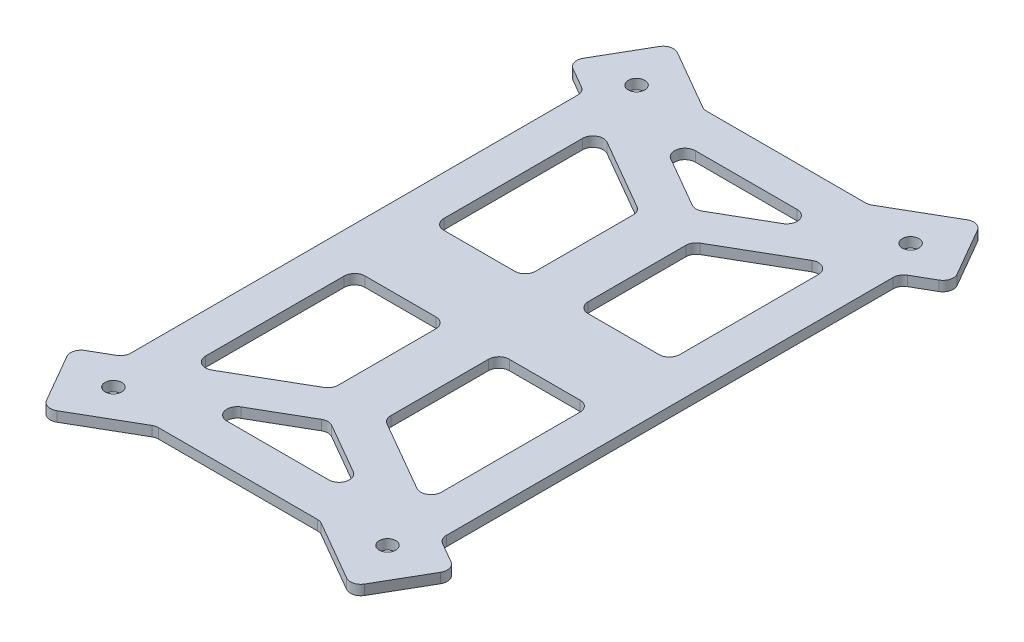
from build123d import *

# Parameters (mm, degrees)
SKETCH2_W               = 48.26
SKETCH2_H               = 83.82
SKETCH2_R               = 1.27
BOSS_EXTRUDE1_DEPTH     = 1.524
SKETCH3_R               = 1.27
BOSS_EXTRUDE2_DEPTH     = 1.524
MIRROR2_COPY_1_SKETCH_R = 1.27
MIRROR2_COPY_1_DEPTH    = 1.524
CUT_EXTRUDE1_DEPTH      = 1.524
MIRROR4_COPY_1_DEPTH    = 1.524
FILLET1_R               = 1.5875


with BuildPart() as part:
    # Sketch2 → Boss-Extrude1 (new body)
    with BuildSketch(Plane(origin=(0, 0, 0), x_dir=(1, 0, 0), z_dir=(0, 1, 0))):
        with Locations((0, -100.64115)):
            Rectangle(SKETCH2_W, SKETCH2_H)
        with Locations(Location((20.955, -140.6398, 0), (0, 0, 90))):
            Circle(SKETCH2_R, mode=Mode.SUBTRACT)
        with Locations(Location((-20.955, -140.6398, 0), (0, 0, 90))):
            Circle(SKETCH2_R, mode=Mode.SUBTRACT)
        with Locations(Location((20.955, -60.6425, 0), (0, 0, 90))):
            Circle(SKETCH2_R, mode=Mode.SUBTRACT)
        with Locations(Location((-20.955, -60.6425, 0), (0, 0, 90))):
            Circle(SKETCH2_R, mode=Mode.SUBTRACT)
    extrude(amount=BOSS_EXTRUDE1_DEPTH)

    # Sketch3 → Boss-Extrude2 (add, through all)
    with BuildSketch(Plane(origin=(0, 0, 0), x_dir=(1, 0, 0), z_dir=(0, 1, 0))):
        Polygon((-2.921, -67.681554482), (23.533261314, -52.408179591), (29.375261314, -62.526820409), (2.921, -77.8001953), align=None)
        with Locations(Location((20.955, -60.6425, 0), (0, 0, 90))):
            Circle(SKETCH3_R, mode=Mode.SUBTRACT)
    boss_extrude2 = extrude(amount=BOSS_EXTRUDE2_DEPTH)

    # Mirror1: Boss-Extrude2 across plane
    add(boss_extrude2.mirror(Plane.XY.offset(100.64115)))

    # Mirror2: Boss-Extrude2 across plane
    add(boss_extrude2.mirror(Plane(origin=(0, 0, 0), x_dir=(0, 0, 1), z_dir=(1, 0, 0))))

    # Mirror2 copy 1 sketch → Mirror2 copy 1 (add, through all)
    with BuildSketch(Plane(origin=(0, 0, 201.2823), x_dir=(-1, 0, 0), z_dir=(0, 1, 0))):
        Polygon((-2.921, -67.681554482), (23.533261314, -52.408179591), (29.375261314, -62.526820409), (2.921, -77.8001953), align=None)
        with Locations(Location((20.955, -60.6425, 0), (0, 0, 90))):
            Circle(MIRROR2_COPY_1_SKETCH_R, mode=Mode.SUBTRACT)
    extrude(amount=MIRROR2_COPY_1_DEPTH)

    # Sketch4 → Cut-Extrude1 (cut)
    with BuildSketch(Plane(origin=(0, 1.524, 0), x_dir=(1, 0, 0), z_dir=(0, 1, 0))):
        Polygon((4.0259, -77.162280987), (4.0259, -94.60865), (18.034, -94.60865), (18.034, -69.074700682), align=None)
        Polygon((4.0259, -64.82715), (4.0259, -70.416520442), (13.706973588, -64.82715), align=None)
        Polygon((4.0259, -64.82715), (0, -64.82715), (0, -72.740874891), (4.0259, -70.416520442), align=None)
    cut_extrude1 = extrude(amount=-CUT_EXTRUDE1_DEPTH, mode=Mode.SUBTRACT)

    # Mirror3: Cut-Extrude1 across plane
    add(cut_extrude1.mirror(Plane(origin=(0, 0, 0), x_dir=(0, 0, 1), z_dir=(1, 0, 0))), mode=Mode.SUBTRACT)

    # Mirror4: Cut-Extrude1 across plane
    add(cut_extrude1.mirror(Plane.XY.offset(100.64115)), mode=Mode.SUBTRACT)

    # Mirror4 copy 1 sketch → Mirror4 copy 1 (cut)
    with BuildSketch(Plane(origin=(0, 1.524, 201.2823), x_dir=(-1, 0, 0), z_dir=(0, 1, 0))):
        Polygon((4.0259, -77.162280987), (4.0259, -94.60865), (18.034, -94.60865), (18.034, -69.074700682), align=None)
        Polygon((4.0259, -64.82715), (4.0259, -70.416520442), (13.706973588, -64.82715), align=None)
        Polygon((4.0259, -64.82715), (0, -64.82715), (0, -72.740874891), (4.0259, -70.416520442), align=None)
    extrude(amount=-MIRROR4_COPY_1_DEPTH, mode=Mode.SUBTRACT)

    # Fillet1
    fillet1_edges = [part.edges().sort_by_distance(p)[0] for p in [
        (-29.375261314, 0.762, 138.755479591),
        (18.034, 0.762, 69.074700682),
        (18.034, 0.762, 94.60865),
        (4.0259, 0.762, 94.60865),
        (4.0259, 0.762, 77.162280987),
        (13.706973588, 0.762, 64.82715),
        (0, 0.762, 72.740874891),
        (-18.034, 0.762, 94.60865),
        (-18.034, 0.762, 69.074700682),
        (-4.0259, 0.762, 77.162280987),
        (-4.0259, 0.762, 94.60865),
        (-13.706973588, 0.762, 64.82715),
        (-18.034, 0.762, 132.207599318),
        (-18.034, 0.762, 106.67365),
        (-4.0259, 0.762, 106.67365),
        (-4.0259, 0.762, 124.120019013),
        (-13.706973588, 0.762, 136.45515),
        (0, 0.762, 128.541425109),
        (18.034, 0.762, 106.67365),
        (18.034, 0.762, 132.207599318),
        (4.0259, 0.762, 124.120019013),
        (4.0259, 0.762, 106.67365),
        (13.706973588, 0.762, 136.45515),
        (24.13, 0.762, 65.555173441),
        (12.581555311, 0.762, 58.73115),
        (29.375261314, 0.762, 62.526820409),
        (23.533261314, 0.762, 52.408179591),
        (12.581555311, 0.762, 142.55115),
        (23.533261314, 0.762, 148.874120409),
        (24.13, 0.762, 135.727126559),
        (29.375261314, 0.762, 138.755479591),
        (-29.375261314, 0.762, 62.526820409),
        (-12.581555311, 0.762, 58.73115),
        (-23.533261314, 0.762, 52.408179591),
        (-24.13, 0.762, 65.555173441),
        (-24.13, 0.762, 135.727126559),
        (-12.581555311, 0.762, 142.55115),
        (-23.533261314, 0.762, 148.874120409),
    ]]
    fillet(fillet1_edges, radius=FILLET1_R)


solid = part.part
